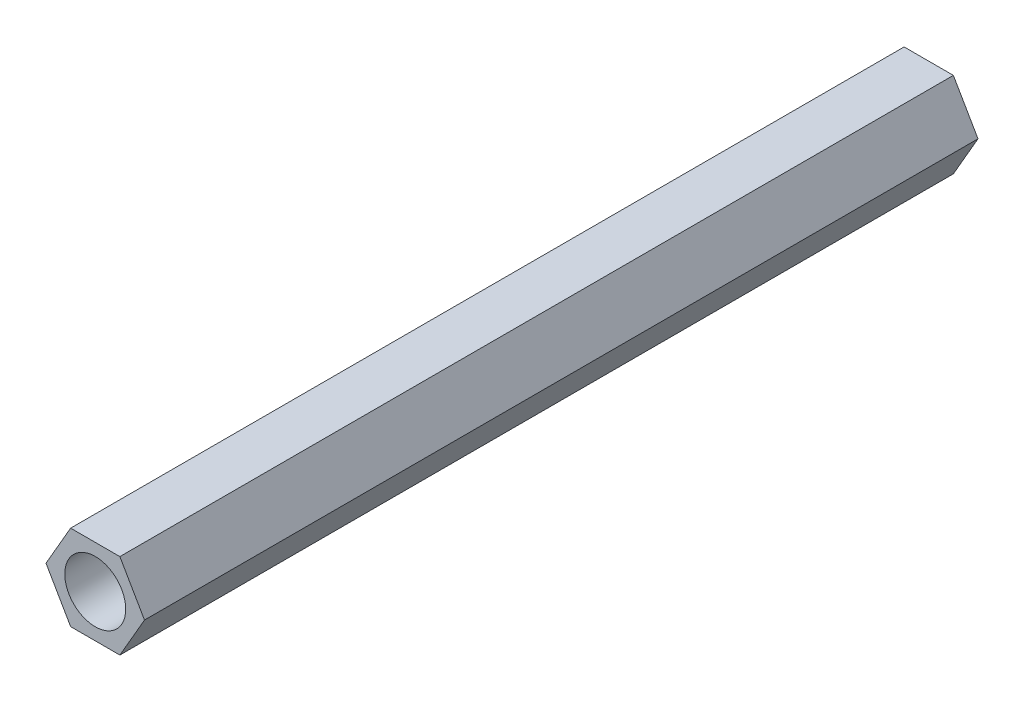
from build123d import *

# Parameters (mm, degrees)
SKETCH1_R           = 2.5
BOSS_EXTRUDE1_DEPTH = 34.2


with BuildPart() as part:
    # Sketch1 → Boss-Extrude1 (new, symmetric)
    with BuildSketch(Plane.XY):
        Polygon((-4.041451884, 0), (-2.020725942, -3.5), (2.020725942, -3.5), (4.041451884, 0), (2.020725942, 3.5), (-2.020725942, 3.5), align=None)
        Circle(SKETCH1_R, mode=Mode.SUBTRACT)
    extrude(amount=BOSS_EXTRUDE1_DEPTH, both=True)


solid = part.part
